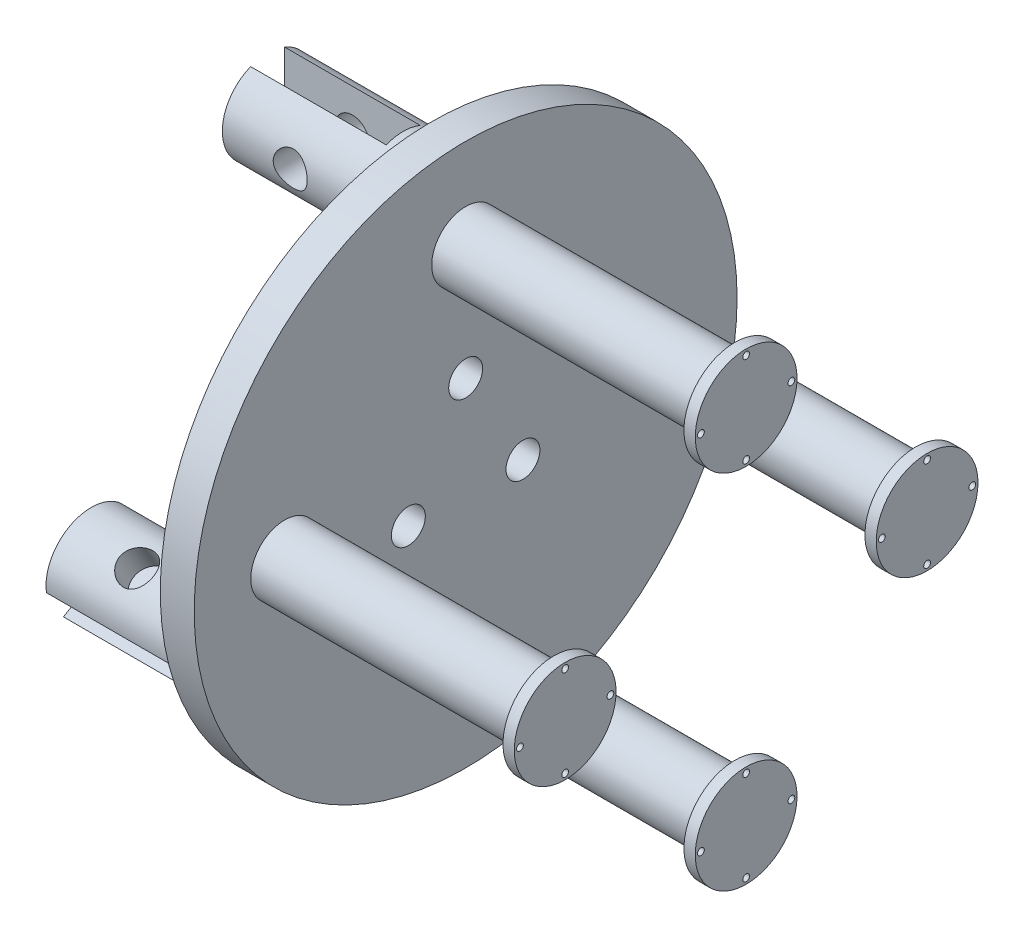
from build123d import *

# Parameters (mm, degrees)
SKETCH_2_R               = 120
EXTRUDE_1_DEPTH          = 15
CUT_EXTRUDE_1_DEPTH      = 171.367250374
CUT_EXTRUDE_1_DEPTH_BACK = 171.367250374
SKETCH_3_R               = 7.5
SKETCH_4_R               = 15
EXTRUDE_2_DEPTH          = 119
SKETCH_5_R               = 20
EXTRUDE_3_DEPTH          = 72.58
SKETCH_7_W               = 15
SKETCH_7_H               = 90.968276451
CUT_EXTRUDE_3_DEPTH      = 60
CUT_EXTRUDE_4_DEPTH      = 222.970934419
CUT_EXTRUDE_4_DEPTH_BACK = 222.970934419
SKETCH_8_R               = 7.5
CUT_EXTRUDE_5_DEPTH      = 222.970934419
CUT_EXTRUDE_5_DEPTH_BACK = 222.970934419
SKETCH_9_R               = 7.5
CUT_EXTRUDE_6_DEPTH      = 221.481858664
CUT_EXTRUDE_6_DEPTH_BACK = 221.481858664
SKETCH_10_R              = 7.5
SKETCH_11_R              = 22.5
EXTRUDE_4_DEPTH          = 5
SKETCH_12_R              = 1.5
CUT_EXTRUDE_7_DEPTH      = 10


with BuildPart() as part:
    # 草图2 → 凸台-拉伸1 (new body)
    with BuildSketch(Plane(origin=(0, 0, 0), x_dir=(0, 0, -1), z_dir=(1, 0, 0))):
        Circle(SKETCH_2_R)
    extrude(amount=EXTRUDE_1_DEPTH)

    # 草图3 → 切除-拉伸1 (cut, two sides: drawn at the far end of the back side and taken through both)
    with BuildSketch(Plane.ZY.offset(-CUT_EXTRUDE_1_DEPTH_BACK)):
        with Locations((0, 29.25)):
            Circle(SKETCH_3_R)
        with Locations((25.331243061, -14.625)):
            Circle(SKETCH_3_R)
        with Locations((-25.331243061, -14.625)):
            Circle(SKETCH_3_R)
    extrude(amount=CUT_EXTRUDE_1_DEPTH + CUT_EXTRUDE_1_DEPTH_BACK, mode=Mode.SUBTRACT)

    # 草图4 → 凸台-拉伸2 (add)
    with BuildSketch(Plane(origin=(15, 0, 0), x_dir=(0, 0, -1), z_dir=(1, 0, 0))):
        with Locations((0, 80)):
            Circle(SKETCH_4_R)
        with Locations((80, 0)):
            Circle(SKETCH_4_R)
        with Locations((0, -80)):
            Circle(SKETCH_4_R)
        with Locations((-80, 0)):
            Circle(SKETCH_4_R)
    extrude(amount=EXTRUDE_2_DEPTH)

    # 草图5 → 凸台-拉伸3 (add)
    with BuildSketch(Plane.ZY):
        with Locations(Location((0, 90, 0), (0, 0, 180))):
            Circle(SKETCH_5_R)
        with Locations(Location((77.942286341, -45, 0), (0, 0, 180))):
            Circle(SKETCH_5_R)
        with Locations(Location((-77.942286341, -45, 0), (0, 0, 180))):
            Circle(SKETCH_5_R)
    extrude(amount=EXTRUDE_3_DEPTH)

    # 草图7 → 切除-拉伸3 (cut)
    with BuildSketch(Plane.ZY.offset(72.58)):
        Polygon((51.844496006, -38.592687763), (130.625334351, -84.076825989), (138.125334351, -71.086444932), (59.344496006, -25.602306706), align=None)
        Polygon((-51.844496006, -38.592687763), (-59.344496006, -25.602306706), (-138.125334351, -71.086444932), (-130.625334351, -84.076825989), align=None)
        with Locations((0, 109.679132694)):
            Rectangle(SKETCH_7_W, SKETCH_7_H)
    extrude(amount=-CUT_EXTRUDE_3_DEPTH, mode=Mode.SUBTRACT)

    # 草图8 → 切除-拉伸4 (cut, two sides: drawn at the far end of the back side and taken through both)
    with BuildSketch(Plane(origin=(0, 6.495190528, 3.75), x_dir=(1, 0, 0), z_dir=(0, -0.8660254037844389, -0.4999999999999997)).offset(-CUT_EXTRUDE_4_DEPTH_BACK)):
        with Locations(Location((-42.58, 90, 0), (0, 0, 270))):
            Circle(SKETCH_8_R)
    extrude(amount=CUT_EXTRUDE_4_DEPTH + CUT_EXTRUDE_4_DEPTH_BACK, mode=Mode.SUBTRACT)

    # 草图9 → 切除-拉伸5 (cut, two sides: drawn at the far end of the back side and taken through both)
    with BuildSketch(Plane(origin=(0, -6.495190528, 3.75), x_dir=(1, 0, 0), z_dir=(0, 0.8660254037844386, -0.5000000000000003)).offset(-CUT_EXTRUDE_5_DEPTH_BACK)):
        with Locations(Location((-42.58, 90, 0), (0, 0, 270))):
            Circle(SKETCH_9_R)
    extrude(amount=CUT_EXTRUDE_5_DEPTH + CUT_EXTRUDE_5_DEPTH_BACK, mode=Mode.SUBTRACT)

    # 草图10 → 切除-拉伸6 (cut, two sides: drawn at the far end of the back side and taken through both)
    with BuildSketch(Plane.XY.offset(-7.5).offset(-CUT_EXTRUDE_6_DEPTH_BACK)):
        with Locations((-42.58, 90)):
            Circle(SKETCH_10_R)
    extrude(amount=CUT_EXTRUDE_6_DEPTH + CUT_EXTRUDE_6_DEPTH_BACK, mode=Mode.SUBTRACT)

    # 草图11 → 凸台-拉伸4 (add)
    with BuildSketch(Plane(origin=(134, 0, 0), x_dir=(0, 0, -1), z_dir=(1, 0, 0))):
        with Locations((-80, 0)):
            Circle(SKETCH_11_R)
        with Locations((0, 80)):
            Circle(SKETCH_11_R)
        with Locations((80, 0)):
            Circle(SKETCH_11_R)
        with Locations((0, -80)):
            Circle(SKETCH_11_R)
    extrude(amount=EXTRUDE_4_DEPTH)

    # 草图12 → 切除-拉伸7 (cut)
    with BuildSketch(Plane(origin=(139, 0, 0), x_dir=(0, 0, -1), z_dir=(1, 0, 0))):
        with Locations((-60, 0)):
            Circle(SKETCH_12_R)
        with Locations((-80, -20)):
            Circle(SKETCH_12_R)
        with Locations((-100, 0)):
            Circle(SKETCH_12_R)
        with Locations((-80, 20)):
            Circle(SKETCH_12_R)
        with Locations((0, 60)):
            Circle(SKETCH_12_R)
        with Locations((60, 0)):
            Circle(SKETCH_12_R)
        with Locations((0, -60)):
            Circle(SKETCH_12_R)
        with Locations((20, 80)):
            Circle(SKETCH_12_R)
        with Locations((80, -20)):
            Circle(SKETCH_12_R)
        with Locations((-20, -80)):
            Circle(SKETCH_12_R)
        with Locations((0, 100)):
            Circle(SKETCH_12_R)
        with Locations((100, 0)):
            Circle(SKETCH_12_R)
        with Locations((0, -100)):
            Circle(SKETCH_12_R)
        with Locations((-20, 80)):
            Circle(SKETCH_12_R)
        with Locations((80, 20)):
            Circle(SKETCH_12_R)
        with Locations((20, -80)):
            Circle(SKETCH_12_R)
    extrude(amount=-CUT_EXTRUDE_7_DEPTH, mode=Mode.SUBTRACT)


solid = part.part
